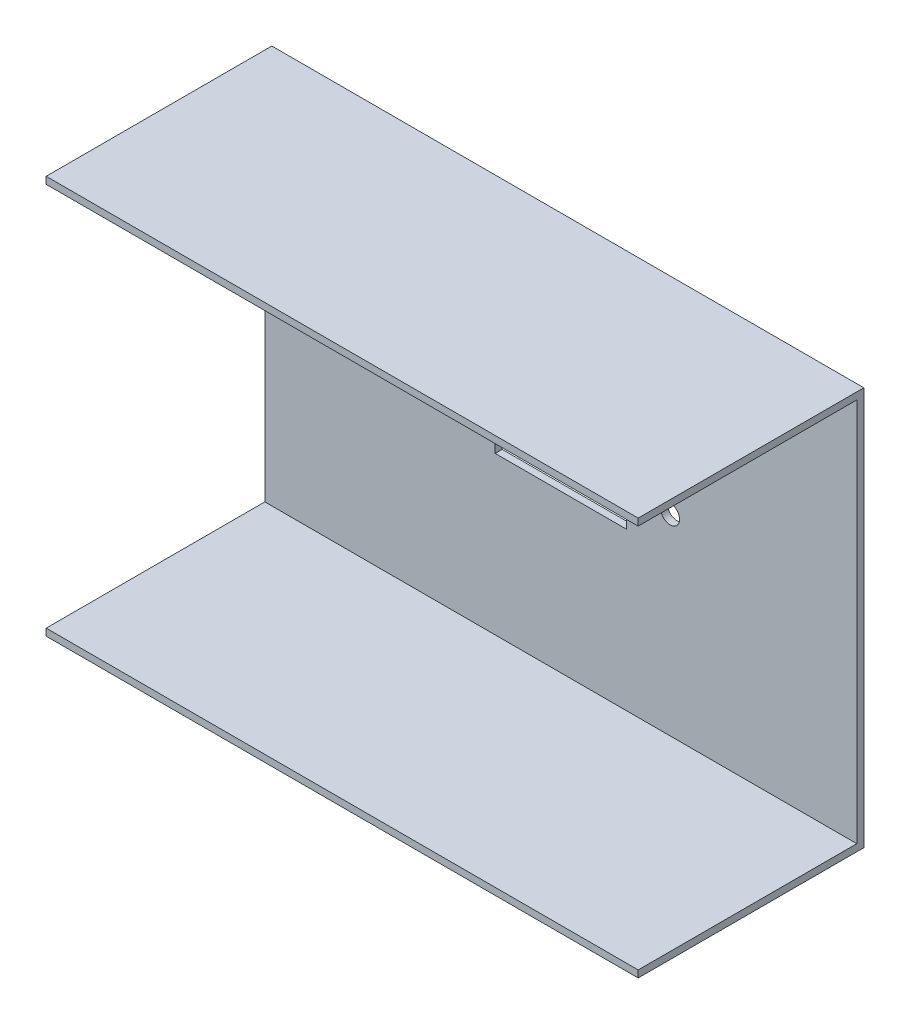
from build123d import *

# Parameters (mm, degrees)
BOSS_EXTRUDE1_DEPTH = 135.3879
SKETCH2_R           = 2.155
SKETCH2_W           = 30
SKETCH2_H           = 20
CUT_EXTRUDE1_DEPTH  = 1.6002


with BuildPart() as part:
    # Sketch1 → Boss-Extrude1 (new body)
    with BuildSketch(Plane(origin=(0, 0, 0), x_dir=(0, 0, -1), z_dir=(1, 0, 0))):
        Polygon((0, 0), (0, -1.6002), (50, -1.6002), (50, -89.49088), (0, -89.49088), (0, -91.09108), (51.6002, -91.09108), (51.6002, 0), align=None)
    extrude(amount=BOSS_EXTRUDE1_DEPTH)

    # Sketch2 → Cut-Extrude1 (cut)
    with BuildSketch(Plane.XY.offset(-50)):
        with Locations((42.69395, -25.54554)):
            Circle(SKETCH2_R)
        with Locations((92.69395, -25.54554)):
            Circle(SKETCH2_R)
        with Locations((42.69395, -45.54554)):
            Circle(SKETCH2_R)
        with Locations((92.69395, -45.54554)):
            Circle(SKETCH2_R)
        with Locations((67.69395, -43.54554)):
            Rectangle(SKETCH2_W, SKETCH2_H)
    extrude(amount=-CUT_EXTRUDE1_DEPTH, mode=Mode.SUBTRACT)


solid = part.part
